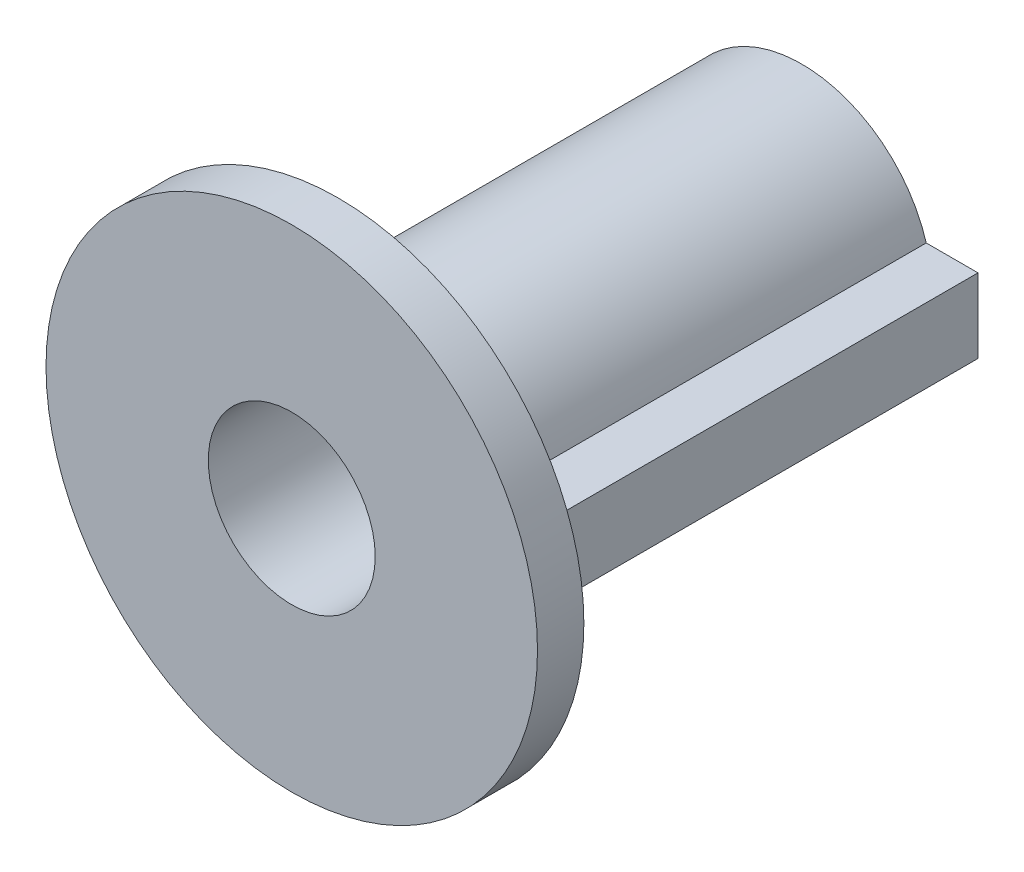
from build123d import *

# Parameters (mm, degrees)
BOSS_EXTRUDE1_DEPTH      = 5
BOSS_EXTRUDE1_DEPTH_BACK = 5
SKETCH1_R                = 1.75
SKETCH4_R                = 5.3
SKETCH4_R_2              = 1.75
BOSS_EXTRUDE2_DEPTH      = 1
M3_CLEARANCE_HOLE1_D     = 3.6


with BuildPart() as part:
    # Sketch1 → Boss-Extrude1 (new, two sides: drawn at the far end of the back side and taken through both)
    with BuildSketch(Plane.XY.offset(-BOSS_EXTRUDE1_DEPTH_BACK)):
        with BuildLine():
            Line((-29.2, 10.8), (-30.316718427, 10.8))
            ThreePointArc((-30.316718427, 10.8), (-35.8, 10), (-30.316718427, 9.2))
            Line((-30.316718427, 9.2), (-29.2, 9.2))
            Line((-29.2, 9.2), (-29.2, 10.8))
        make_face()
        with Locations(Location((-33, 10, 0), (0, 0, 180))):
            Circle(SKETCH1_R, mode=Mode.SUBTRACT)
    extrude(amount=BOSS_EXTRUDE1_DEPTH + BOSS_EXTRUDE1_DEPTH_BACK)

    # Sketch4 → Boss-Extrude2 (add)
    with BuildSketch(Plane.XY.offset(5)):
        with Locations((-33, 10)):
            Circle(SKETCH4_R)
        with Locations((-33, 10)):
            Circle(SKETCH4_R_2, mode=Mode.SUBTRACT)
    extrude(amount=BOSS_EXTRUDE2_DEPTH)

    # M3 Clearance Hole1 (through all)
    with Locations(Plane.XY.offset(6)):
        with Locations((-33, 10)):
            Hole(M3_CLEARANCE_HOLE1_D / 2)


solid = part.part
